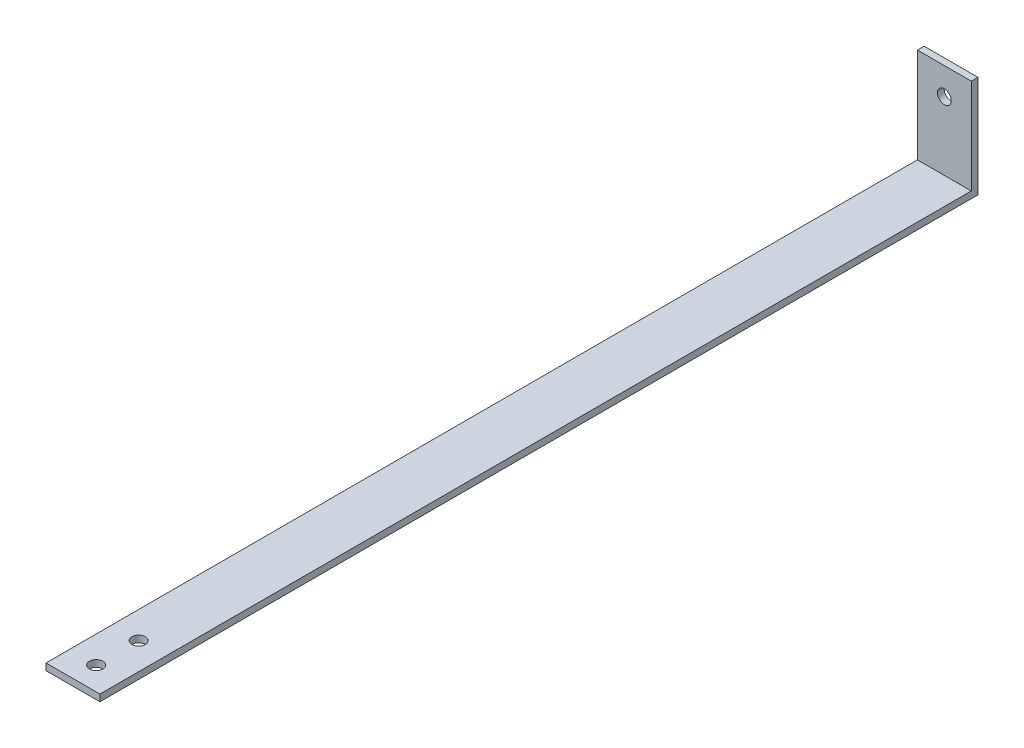
from build123d import *

# Parameters (mm, degrees)
SALIENTE_EXTRUIR1_DEPTH = 50.8
CROQUIS2_R              = 6.5
CORTAR_EXTRUIR1_DEPTH   = 10
CROQUIS3_R              = 6.5
CORTAR_EXTRUIR2_DEPTH   = 10
CROQUIS4_W              = 50.8
CROQUIS4_H              = 74.5
CORTAR_EXTRUIR3_DEPTH   = 10
CROQUIS5_R              = 6.35
CORTAR_EXTRUIR4_DEPTH   = 10


with BuildPart() as part:
    # Croquis1 → Saliente-Extruir1 (new body)
    with BuildSketch(Plane(origin=(0, 0, 0), x_dir=(0, 0, -1), z_dir=(1, 0, 0))):
        Polygon((-6.31, 95.93), (0, 95.93), (0, 0), (-902.2, 0), (-902.2, 6.31), (-6.31, 6.31), align=None)
    extrude(amount=SALIENTE_EXTRUIR1_DEPTH)

    # Croquis2 → Cortar-Extruir1 (cut)
    with BuildSketch(Plane(origin=(0, 0, 0), x_dir=(-1, 0, 0), z_dir=(0, -1, 0))):
        with Locations(Location((-25.4, -885.7, 0), (0, 0, 90))):
            Circle(CROQUIS2_R)
        with Locations(Location((-25.4, -854.7, 0), (0, 0, 90))):
            Circle(CROQUIS2_R)
    extrude(amount=-CORTAR_EXTRUIR1_DEPTH, mode=Mode.SUBTRACT)

    # Croquis3 → Cortar-Extruir2 (cut)
    with BuildSketch(Plane(origin=(0, 0, 0), x_dir=(-1, 0, 0), z_dir=(0, 0, -1))):
        with Locations(Location((-25.4, 70.53, 0), (0, 0, 90))):
            Circle(CROQUIS3_R)
    extrude(amount=-CORTAR_EXTRUIR2_DEPTH, mode=Mode.SUBTRACT)

    # Croquis4 → Cortar-Extruir3 (cut)
    with BuildSketch(Plane.XZ):
        with Locations((25.4, 864.95)):
            Rectangle(CROQUIS4_W, CROQUIS4_H)
    extrude(amount=-CORTAR_EXTRUIR3_DEPTH, mode=Mode.SUBTRACT)

    # Croquis5 → Cortar-Extruir4 (cut)
    with BuildSketch(Plane(origin=(0, 0, 0), x_dir=(-1, 0, 0), z_dir=(0, -1, 0))):
        with Locations(Location((-25.4, -765.81, 0), (0, 0, 90))):
            Circle(CROQUIS5_R)
        with Locations(Location((-25.4, -805.81, 0), (0, 0, 90))):
            Circle(CROQUIS5_R)
    extrude(amount=-CORTAR_EXTRUIR4_DEPTH, mode=Mode.SUBTRACT)


solid = part.part
